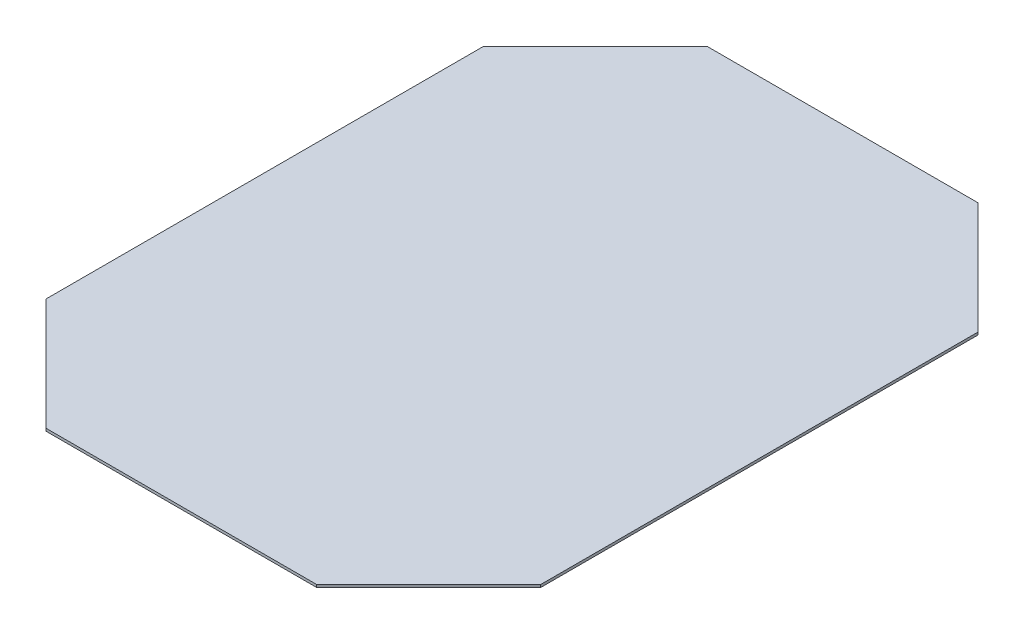
from build123d import *

# Parameters (mm, degrees)
BOSS_EXTRUDE1_DEPTH = 1.5875


with BuildPart() as part:
    # Sketch1 → Boss-Extrude1 (new body)
    with BuildSketch(Plane(origin=(0, 0, 0), x_dir=(1, 0, 0), z_dir=(0, 1, 0))):
        Polygon((-82.55, 201.6125), (82.55, 201.6125), (150.8125, 133.35), (150.8125, -133.35), (82.55, -201.6125), (-82.55, -201.6125), (-150.8125, -133.35), (-150.8125, 133.35), align=None)
    extrude(amount=BOSS_EXTRUDE1_DEPTH)


solid = part.part
